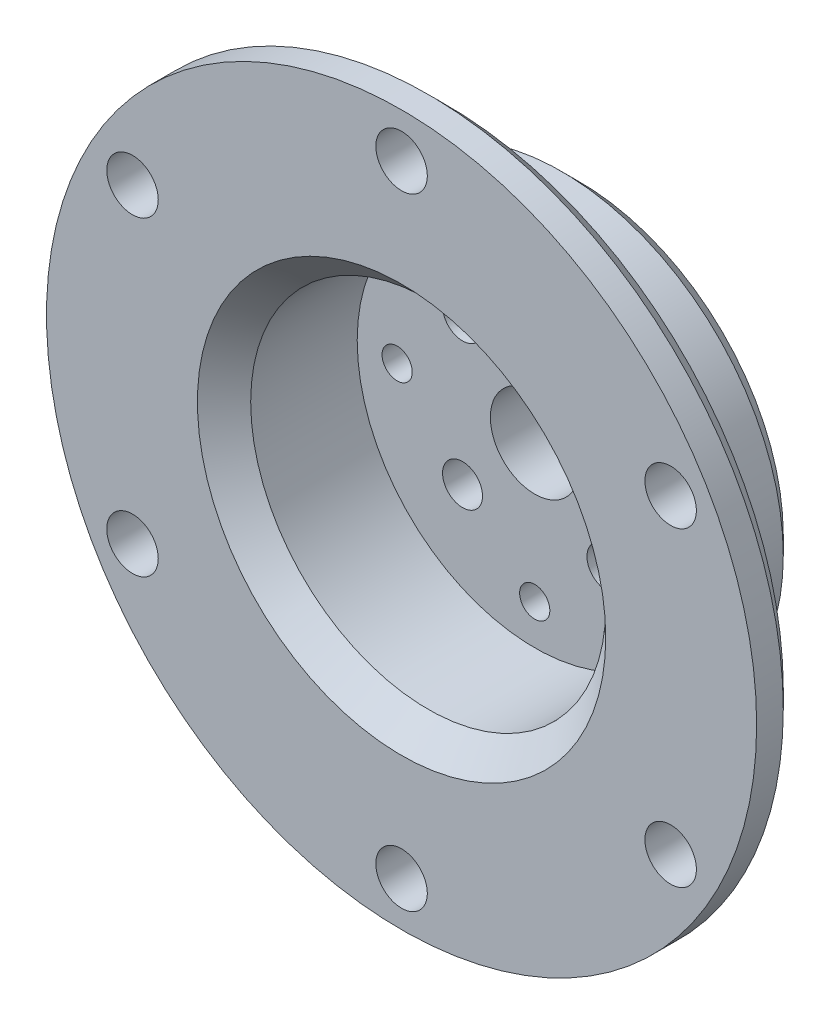
from build123d import *

# Parameters (mm, degrees)
CUT_EXTRUDE_1_REACH = 62
SKETCH_9_R          = 2.25
SKETCH_9_R_2        = 5
SKETCH_9_R_3        = 1.7
SKETCH_11_R         = 2.9
CUT_EXTRUDE_2_DEPTH = 10


with BuildPart() as part:
    # 草图1 → 旋转1 (revolve)
    with BuildSketch(Plane(origin=(0, 0, 0), x_dir=(1, 0, 0), z_dir=(0, 1, 0))):
        Polygon((38, -15), (25, -15), (25, -2), (23, 0), (0, 0), (0, -5), (20, -5), (20, -17), (23, -20), (40, -20), (40, -17), align=None)
    revolve(axis=Axis((0, 0, 0), (0, 0, 1)))

    # 草图9 → 切除-拉伸1 (cut, up to next)
    with BuildSketch(Plane(origin=(0, 0, 0), x_dir=(-1, 0, 0), z_dir=(0, 0, -1)), mode=Mode.PRIVATE) as cut_extrude_1_sk1:
        with Locations((-8.131727984, 8.131727984)):
            Circle(SKETCH_9_R)
    cut_extrude_1_tool1 = extrude(cut_extrude_1_sk1.sketch, amount=-CUT_EXTRUDE_1_REACH, mode=Mode.PRIVATE) & part.part
    # 草图9 → 切除-拉伸1 (cut, up to next)
    with BuildSketch(Plane(origin=(0, 0, 0), x_dir=(-1, 0, 0), z_dir=(0, 0, -1)), mode=Mode.PRIVATE) as cut_extrude_1_sk2:
        with Locations((8.131727984, 8.131727984)):
            Circle(SKETCH_9_R)
    cut_extrude_1_tool2 = extrude(cut_extrude_1_sk2.sketch, amount=-CUT_EXTRUDE_1_REACH, mode=Mode.PRIVATE) & part.part
    # 草图9 → 切除-拉伸1 (cut, up to next)
    with BuildSketch(Plane(origin=(0, 0, 0), x_dir=(-1, 0, 0), z_dir=(0, 0, -1)), mode=Mode.PRIVATE) as cut_extrude_1_sk3:
        with Locations((8.131727984, -8.131727984)):
            Circle(SKETCH_9_R)
    cut_extrude_1_tool3 = extrude(cut_extrude_1_sk3.sketch, amount=-CUT_EXTRUDE_1_REACH, mode=Mode.PRIVATE) & part.part
    # 草图9 → 切除-拉伸1 (cut, up to next)
    with BuildSketch(Plane(origin=(0, 0, 0), x_dir=(-1, 0, 0), z_dir=(0, 0, -1)), mode=Mode.PRIVATE) as cut_extrude_1_sk4:
        with Locations((-8.131727984, -8.131727984)):
            Circle(SKETCH_9_R)
    cut_extrude_1_tool4 = extrude(cut_extrude_1_sk4.sketch, amount=-CUT_EXTRUDE_1_REACH, mode=Mode.PRIVATE) & part.part
    # 草图9 → 切除-拉伸1 (cut, up to next)
    with BuildSketch(Plane(origin=(0, 0, 0), x_dir=(-1, 0, 0), z_dir=(0, 0, -1)), mode=Mode.PRIVATE) as cut_extrude_1_sk5:
        Circle(SKETCH_9_R_2)
    cut_extrude_1_tool5 = extrude(cut_extrude_1_sk5.sketch, amount=-CUT_EXTRUDE_1_REACH, mode=Mode.PRIVATE) & part.part
    # 草图9 → 切除-拉伸1 (cut, up to next)
    with BuildSketch(Plane(origin=(0, 0, 0), x_dir=(-1, 0, 0), z_dir=(0, 0, -1)), mode=Mode.PRIVATE) as cut_extrude_1_sk6:
        with Locations((0, 15.5)):
            Circle(SKETCH_9_R_3)
    cut_extrude_1_tool6 = extrude(cut_extrude_1_sk6.sketch, amount=-CUT_EXTRUDE_1_REACH, mode=Mode.PRIVATE) & part.part
    # 草图9 → 切除-拉伸1 (cut, up to next)
    with BuildSketch(Plane(origin=(0, 0, 0), x_dir=(-1, 0, 0), z_dir=(0, 0, -1)), mode=Mode.PRIVATE) as cut_extrude_1_sk7:
        with Locations((-15.5, 0)):
            Circle(SKETCH_9_R_3)
    cut_extrude_1_tool7 = extrude(cut_extrude_1_sk7.sketch, amount=-CUT_EXTRUDE_1_REACH, mode=Mode.PRIVATE) & part.part
    # 草图9 → 切除-拉伸1 (cut, up to next)
    with BuildSketch(Plane(origin=(0, 0, 0), x_dir=(-1, 0, 0), z_dir=(0, 0, -1)), mode=Mode.PRIVATE) as cut_extrude_1_sk8:
        with Locations((0, -15.5)):
            Circle(SKETCH_9_R_3)
    cut_extrude_1_tool8 = extrude(cut_extrude_1_sk8.sketch, amount=-CUT_EXTRUDE_1_REACH, mode=Mode.PRIVATE) & part.part
    # 草图9 → 切除-拉伸1 (cut, up to next)
    with BuildSketch(Plane(origin=(0, 0, 0), x_dir=(-1, 0, 0), z_dir=(0, 0, -1)), mode=Mode.PRIVATE) as cut_extrude_1_sk9:
        with Locations((15.5, 0)):
            Circle(SKETCH_9_R_3)
    cut_extrude_1_tool9 = extrude(cut_extrude_1_sk9.sketch, amount=-CUT_EXTRUDE_1_REACH, mode=Mode.PRIVATE) & part.part
    add(cut_extrude_1_tool1.solids().sort_by_distance((8.131728, 8.131728, 0))[0], mode=Mode.SUBTRACT)
    add(cut_extrude_1_tool2.solids().sort_by_distance((-8.131728, 8.131728, 0))[0], mode=Mode.SUBTRACT)
    add(cut_extrude_1_tool3.solids().sort_by_distance((-8.131728, -8.131728, 0))[0], mode=Mode.SUBTRACT)
    add(cut_extrude_1_tool4.solids().sort_by_distance((8.131728, -8.131728, 0))[0], mode=Mode.SUBTRACT)
    add(cut_extrude_1_tool5.solids().sort_by_distance((0, 0, 0))[0], mode=Mode.SUBTRACT)
    add(cut_extrude_1_tool6.solids().sort_by_distance((0, 15.5, 0))[0], mode=Mode.SUBTRACT)
    add(cut_extrude_1_tool7.solids().sort_by_distance((15.5, 0, 0))[0], mode=Mode.SUBTRACT)
    add(cut_extrude_1_tool8.solids().sort_by_distance((0, -15.5, 0))[0], mode=Mode.SUBTRACT)
    add(cut_extrude_1_tool9.solids().sort_by_distance((-15.5, 0, 0))[0], mode=Mode.SUBTRACT)

    # 草图11 → 切除-拉伸2 (cut)
    with BuildSketch(Plane.XY.offset(20)):
        with Locations((0, 35)):
            Circle(SKETCH_11_R)
        with Locations((-30.310889132, 17.5)):
            Circle(SKETCH_11_R)
        with Locations((-30.310889132, -17.5)):
            Circle(SKETCH_11_R)
        with Locations((0, -35)):
            Circle(SKETCH_11_R)
        with Locations((30.310889132, -17.5)):
            Circle(SKETCH_11_R)
        with Locations((30.310889132, 17.5)):
            Circle(SKETCH_11_R)
    extrude(amount=-CUT_EXTRUDE_2_DEPTH, mode=Mode.SUBTRACT)


solid = part.part
